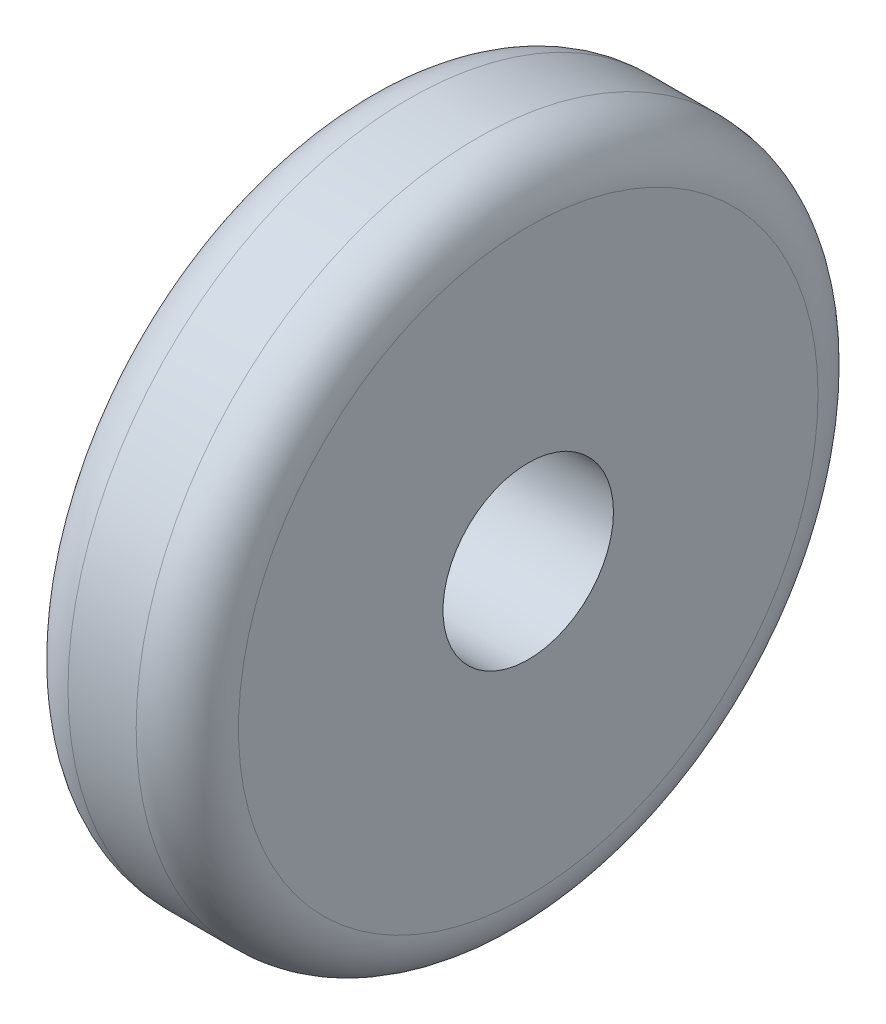
from build123d import *

# Parameters (mm, degrees)
SKETCH1_R           = 20
SKETCH1_R_2         = 5
BOSS_EXTRUDE1_DEPTH = 5
FILLET1_R           = 3


with BuildPart() as part:
    # Sketch1 → Boss-Extrude1 (new, symmetric)
    with BuildSketch(Plane(origin=(0, 0, 0), x_dir=(0, 0, -1), z_dir=(1, 0, 0))):
        Circle(SKETCH1_R)
        Circle(SKETCH1_R_2, mode=Mode.SUBTRACT)
    extrude(amount=BOSS_EXTRUDE1_DEPTH, both=True)

    # Fillet1
    fillet1_edges = [part.edges().sort_by_distance(p)[0] for p in [
        (-5, 0, 20),
        (5, 0, 20),
    ]]
    fillet(fillet1_edges, radius=FILLET1_R)


solid = part.part
